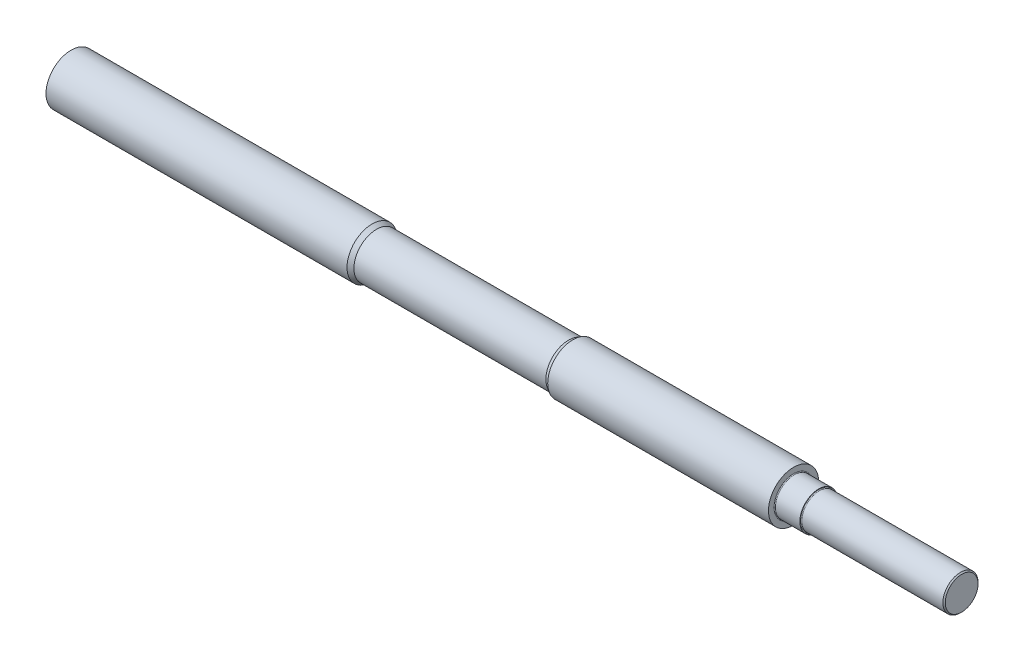
from build123d import *


with BuildPart() as part:
    # 草图1 → 旋转1 (revolve)
    with BuildSketch(Plane.XY):
        with BuildLine():
            Line((288, 0), (288, 7.8))
            ThreePointArc((288, 7.8), (288.087867966, 7.587867966), (288.3, 7.5))
            Line((288.3, 7.5), (298, 7.5))
            Line((298, 7.5), (298, 7.3))
            ThreePointArc((298, 7.3), (298.087867966, 7.087867966), (298.3, 7))
            Line((298.3, 7), (354.533333333, 7))
            Line((354.533333333, 7), (355, 6.533333333))
            Line((355, 6.533333333), (355, 0))
            Line((355, 0), (288, 0))
        make_face()
    revolve(axis=Axis((355, 0, 0), (-1, 0, 0)))

    # 草图2 → 旋转2 (revolve)
    with BuildSketch(Plane.XY):
        Polygon((0, 0), (0, 10), (120, 10), (121.732050808, 9), (198.267949192, 9), (200, 10), (288, 10), (288, 0), align=None)
    revolve(axis=Axis((288, 0, 0), (-1, 0, 0)))

    # 草图3 → 切除-旋转1 (revolve, cut)
    with BuildSketch(Plane.XY):
        Polygon((0, 0), (0, 5), (0.812, 4.188), (24, 4.188), (26.417942927, 0), align=None)
    revolve(axis=Axis((26.417942927, 0, 0), (-1, 0, 0)), mode=Mode.SUBTRACT)


solid = part.part
